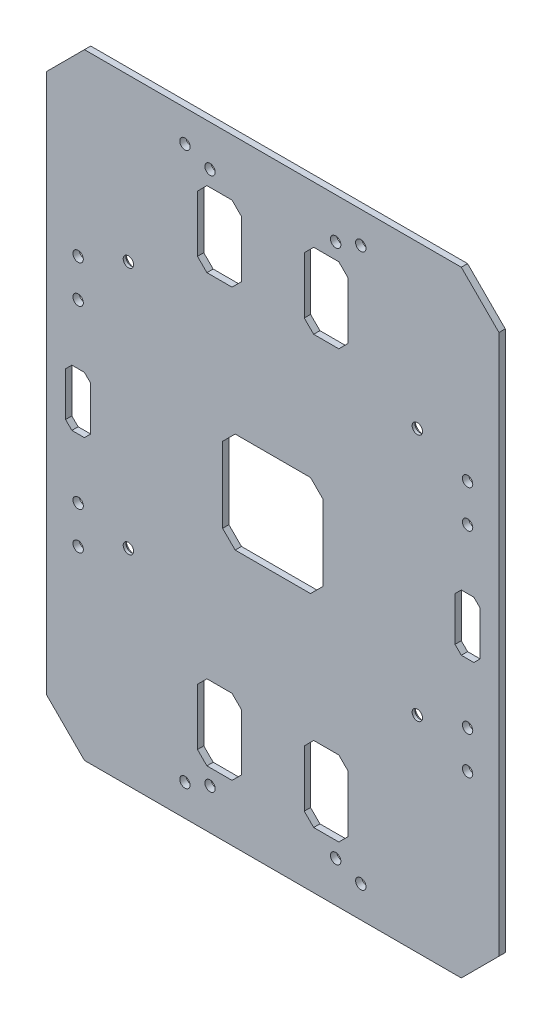
from build123d import *

# Parameters (mm, degrees)
SKETCH_7_R            = 1.65
EXTRUDE_542_DEPTH     = 2
SKETCH_8_R            = 2.75
CUT_EXTRUDE_611_DEPTH = 1.1


with BuildPart() as part:
    # 草图7 → Extrude 542 (new body)
    with BuildSketch(Plane.XY):
        Polygon((-60, -98), (60, -98), (72, -86), (72, 86), (60, 98), (-60, 98), (-72, 86), (-72, -86), align=None)
        with Locations((-20, -85)):
            Circle(SKETCH_7_R, mode=Mode.SUBTRACT)
        with Locations((-62, -28)):
            Circle(SKETCH_7_R, mode=Mode.SUBTRACT)
        with Locations((-28, -88)):
            Circle(SKETCH_7_R, mode=Mode.SUBTRACT)
        with Locations((-62, -40)):
            Circle(SKETCH_7_R, mode=Mode.SUBTRACT)
        with Locations((-20, 85)):
            Circle(SKETCH_7_R, mode=Mode.SUBTRACT)
        with Locations((-62, 28)):
            Circle(SKETCH_7_R, mode=Mode.SUBTRACT)
        with Locations((-28, 88)):
            Circle(SKETCH_7_R, mode=Mode.SUBTRACT)
        with Locations((-62, 40)):
            Circle(SKETCH_7_R, mode=Mode.SUBTRACT)
        with Locations((20, -85)):
            Circle(SKETCH_7_R, mode=Mode.SUBTRACT)
        with Locations((62, -28)):
            Circle(SKETCH_7_R, mode=Mode.SUBTRACT)
        with Locations((28, -88)):
            Circle(SKETCH_7_R, mode=Mode.SUBTRACT)
        with Locations((62, -40)):
            Circle(SKETCH_7_R, mode=Mode.SUBTRACT)
        with Locations((20, 85)):
            Circle(SKETCH_7_R, mode=Mode.SUBTRACT)
        with Locations((62, 28)):
            Circle(SKETCH_7_R, mode=Mode.SUBTRACT)
        with Locations((28, 88)):
            Circle(SKETCH_7_R, mode=Mode.SUBTRACT)
        with Locations((62, 40)):
            Circle(SKETCH_7_R, mode=Mode.SUBTRACT)
        with Locations((-46, -32.5)):
            Circle(SKETCH_7_R, mode=Mode.SUBTRACT)
        with Locations((-46, 46.5)):
            Circle(SKETCH_7_R, mode=Mode.SUBTRACT)
        with Locations((46, -32.5)):
            Circle(SKETCH_7_R, mode=Mode.SUBTRACT)
        with Locations((46, 46.5)):
            Circle(SKETCH_7_R, mode=Mode.SUBTRACT)
        Polygon((-64, -9), (-60, -9), (-58, -7), (-58, 7), (-60, 9), (-64, 9), (-66, 7), (-66, -7), align=None, mode=Mode.SUBTRACT)
        Polygon((-21, 56), (-13, 56), (-10, 59), (-10, 77), (-13, 80), (-21, 80), (-24, 77), (-24, 59), align=None, mode=Mode.SUBTRACT)
        Polygon((-21, -80), (-13, -80), (-10, -77), (-10, -59), (-13, -56), (-21, -56), (-24, -59), (-24, -77), align=None, mode=Mode.SUBTRACT)
        Polygon((60, -9), (64, -9), (66, -7), (66, 7), (64, 9), (60, 9), (58, 7), (58, -7), align=None, mode=Mode.SUBTRACT)
        Polygon((13, 56), (21, 56), (24, 59), (24, 77), (21, 80), (13, 80), (10, 77), (10, 59), align=None, mode=Mode.SUBTRACT)
        Polygon((13, -80), (21, -80), (24, -77), (24, -59), (21, -56), (13, -56), (10, -59), (10, -77), align=None, mode=Mode.SUBTRACT)
        Polygon((-12, -16), (12, -16), (16, -12), (16, 12), (12, 16), (-12, 16), (-16, 12), (-16, -12), align=None, mode=Mode.SUBTRACT)
    extrude(amount=EXTRUDE_542_DEPTH)

    # 草图8 → Cut-Extrude 611 (cut)
    with BuildSketch(Plane.XY):
        with Locations((-46, -32.5)):
            Circle(SKETCH_8_R)
        with Locations((-46, 46.5)):
            Circle(SKETCH_8_R)
        with Locations((46, -32.5)):
            Circle(SKETCH_8_R)
        with Locations((46, 46.5)):
            Circle(SKETCH_8_R)
    extrude(amount=CUT_EXTRUDE_611_DEPTH, mode=Mode.SUBTRACT)


solid = part.part
